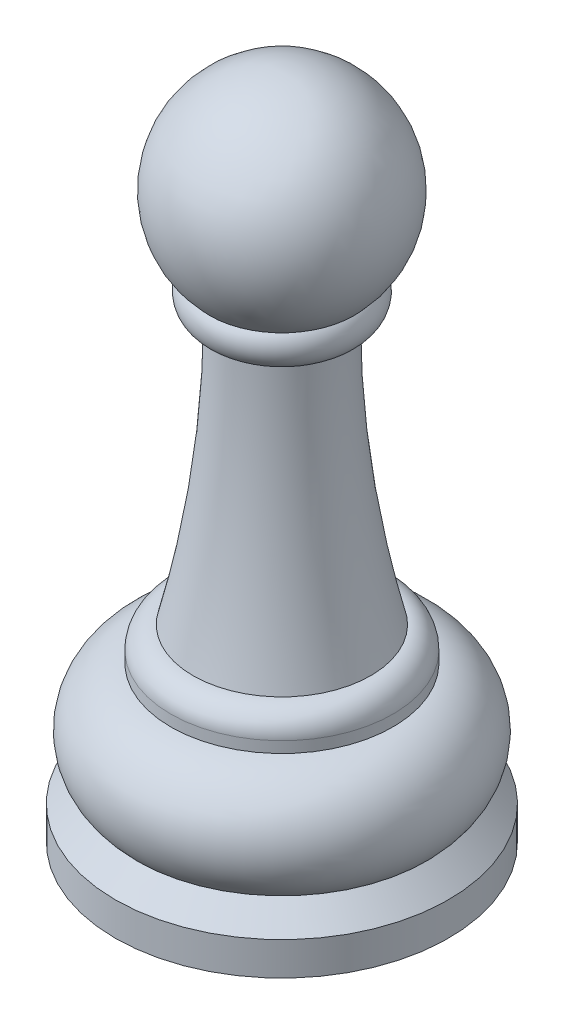
from build123d import *


with BuildPart() as part:
    # Croquis1 → Revolución3 (revolve)
    with BuildSketch(Plane.XY, mode=Mode.PRIVATE) as revoluci_n3_sk:
        with BuildLine():
            Line((0, 0), (15, 0))
            Line((15, 0), (15, 3))
            Line((15, 3), (13, 5))
            ThreePointArc((13, 5), (14.274991786, 10.413090898), (10, 13.97))
            Line((10, 13.97), (10, 14.97))
            ThreePointArc((10, 14.97), (9.414213562, 16.384213562), (8, 16.97))
            ThreePointArc((8, 16.97), (5.752892651, 28.90684447), (5, 41.03))
            ThreePointArc((5, 41.03), (6.794268653, 42.179508288), (6.5, 44.29))
            ThreePointArc((6.5, 44.29), (8.500795551, 54.317512481), (0, 60))
            Line((0, 60), (0, 0))
        make_face()
    revolve(revoluci_n3_sk.sketch.rotate(Axis((0, 60, 0), (0, -1, 0)), 90), axis=Axis((0, 60, 0), (0, -1, 0)))


solid = part.part
